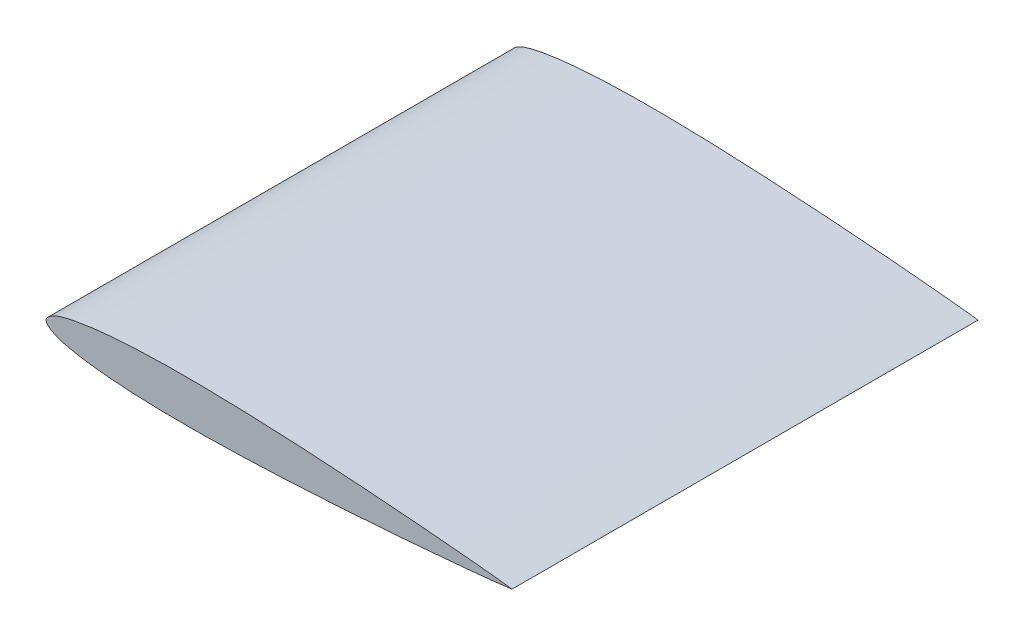
from build123d import *

# Parameters (mm, degrees)
BOSS_EXTRUDE1_DEPTH = 100


with BuildPart() as part:
    # Sketch1 → Boss-Extrude1 (new body)
    with BuildSketch(Plane.XY):
        with BuildLine():
            add(Edge.make_bspline(
                [(73.185848608, 0.026856861), (73.185848608, 0.045961226), (72.272359976, 0.121970756), (71.335482878, 0.280581868), (69.059740399, 0.523745586), (66.263666687, 0.825580782), (62.620401639, 1.179781823), (58.343008013, 1.570665866), (53.450200471, 1.990684674), (48.044364045, 2.427547609), (42.211685773, 2.863804944), (36.053867233, 3.286530093), (29.675827116, 3.676271353), (23.186772036, 4.016523834), (16.69749908, 4.287061367), (11.339284111, 4.443346384), (7.136069419, 4.515142624), (4.078240646, 4.540622778), (1.102018646, 4.537063511), (-1.779867103, 4.498751551), (-4.554851396, 4.431501334), (-7.210821848, 4.329938945), (-9.736615921, 4.197762505), (-12.121751884, 4.031890864), (-14.356116187, 3.835130711), (-16.429418832, 3.605759286), (-18.3330179, 3.348149339), (-20.059470232, 3.068941856), (-21.601585648, 2.769387399), (-22.954354525, 2.450524099), (-24.111370696, 2.101613591), (-25.070122826, 1.716193366), (-25.821838425, 1.290935182), (-26.362413647, 0.846871787), (-26.70000664, 0.439870053), (-26.862888614, 0.026856861), (-26.70000664, -0.386156331), (-26.362413647, -0.793158065), (-25.821838425, -1.23722146), (-25.070122826, -1.662479644), (-24.111370696, -2.047899869), (-22.954354525, -2.396810377), (-21.601585648, -2.715673677), (-20.059470232, -3.015228134), (-18.3330179, -3.294435617), (-16.429418832, -3.552045564), (-14.356116187, -3.781416989), (-12.121751884, -3.978177142), (-9.736615921, -4.144048784), (-7.210821848, -4.276225223), (-4.554851396, -4.377787612), (-1.779867103, -4.445037829), (1.102018646, -4.483349789), (4.078240646, -4.486909056), (7.136069419, -4.461428902), (11.339284111, -4.389632662), (16.69749908, -4.233347645), (23.186772036, -3.962810112), (29.675827116, -3.622557631), (36.053867233, -3.232816371), (42.211685773, -2.810091222), (48.044364045, -2.373833887), (53.450200471, -1.936970952), (58.343008013, -1.516952144), (62.620401639, -1.126068101), (66.263666687, -0.77186706), (69.059740399, -0.470031864), (71.335482878, -0.226868146), (72.272359976, -0.068257034), (73.185848608, 0.007752496), (73.185848608, 0.026856861)],
                knots=[0, 0, 0, 0, 0.002133427, 0.008488156, 0.018944487, 0.033319114, 0.051356294, 0.072756093, 0.097140817, 0.124097489, 0.153162557, 0.183833918, 0.215589374, 0.247878195, 0.280150868, 0.311860397, 0.327332943, 0.342462846, 0.357187102, 0.371448118, 0.385183441, 0.398331273, 0.410844637, 0.422672607, 0.433769314, 0.444090175, 0.453589412, 0.46224044, 0.470010037, 0.476870985, 0.482833353, 0.487908551, 0.492155164, 0.495592273, 0.498196359, 0.5, 0.501803641, 0.504407727, 0.507844836, 0.512091449, 0.517166647, 0.523129015, 0.529989963, 0.53775956, 0.546410588, 0.555909825, 0.566230686, 0.577327393, 0.589155363, 0.601668727, 0.614816559, 0.628551882, 0.642812898, 0.657537154, 0.672667057, 0.688139603, 0.719849132, 0.752121805, 0.784410626, 0.816166082, 0.846837443, 0.875902511, 0.902859183, 0.927243907, 0.948643706, 0.966680886, 0.981055513, 0.991511844, 0.997866573, 1, 1, 1, 1], degree=3))
        make_face()
    extrude(amount=BOSS_EXTRUDE1_DEPTH)


solid = part.part
